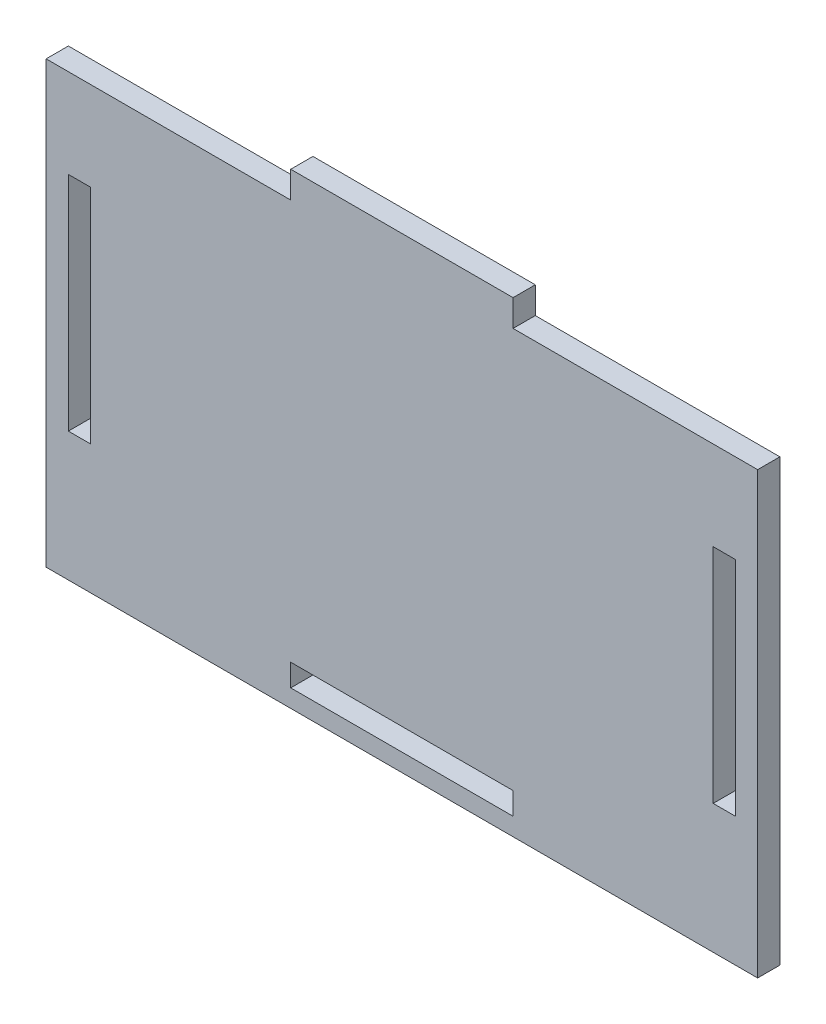
from build123d import *

# Parameters (mm, degrees)
SKETCH1_W           = 31.75
SKETCH1_H           = 3.175
SKETCH1_W_2         = 3.175
SKETCH1_H_2         = 31.75
BOSS_EXTRUDE1_DEPTH = 3.175


with BuildPart() as part:
    # Sketch1 → Boss-Extrude1 (new body)
    with BuildSketch(Plane.XY):
        Polygon((-50.8, 28.575), (-15.875, 28.575), (-15.875, 32.385), (15.875, 32.385), (15.875, 28.575), (50.8, 28.575), (50.8, -34.29), (-50.8, -34.29), align=None)
        with Locations((0, -30.1625)):
            Rectangle(SKETCH1_W, SKETCH1_H, mode=Mode.SUBTRACT)
        with Locations((-46.0375, 0)):
            Rectangle(SKETCH1_W_2, SKETCH1_H_2, mode=Mode.SUBTRACT)
        with Locations((46.0375, 0)):
            Rectangle(SKETCH1_W_2, SKETCH1_H_2, mode=Mode.SUBTRACT)
    extrude(amount=BOSS_EXTRUDE1_DEPTH)


solid = part.part
